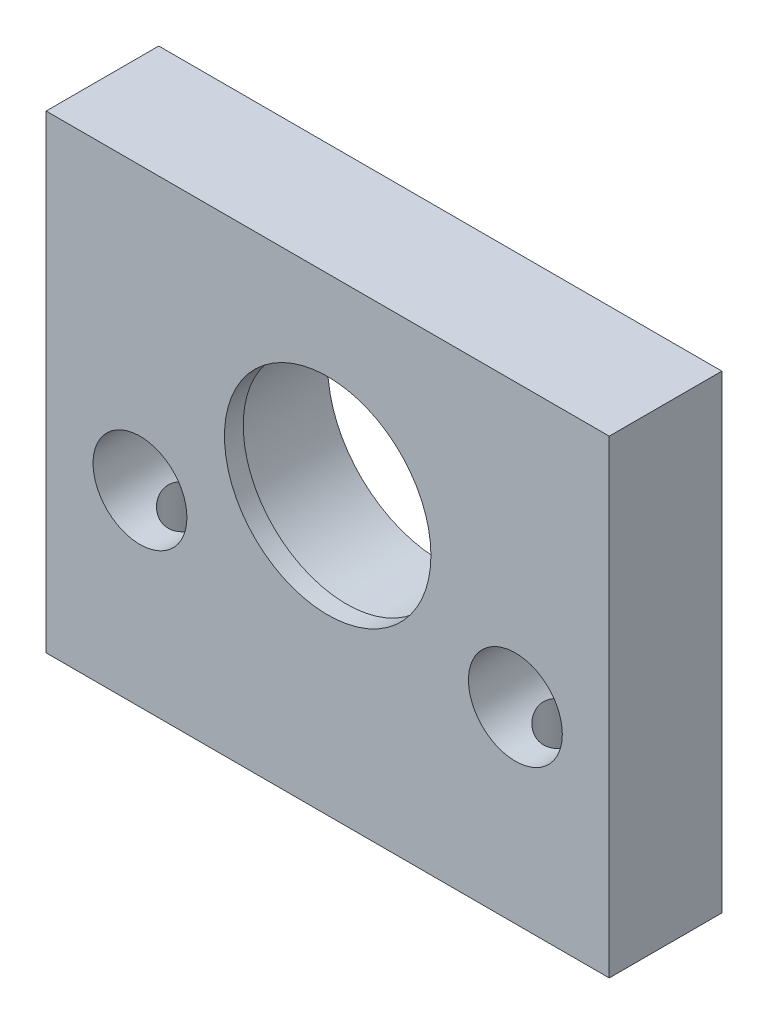
from build123d import *

# Parameters (mm, degrees)
SKETCH1_W           = 60
SKETCH1_H           = 50
BOSS_EXTRUDE1_DEPTH = 12
SKETCH2_R           = 11
CUT_EXTRUDE1_DEPTH  = 2
CUT_EXTRUDE2_REACH  = 42.853
SKETCH3_R           = 5
CUT_EXTRUDE3_REACH  = 61.532
SKETCH4_R           = 3
CUT_EXTRUDE5_REACH  = 42.311
SKETCH6_R           = 12


with BuildPart() as part:
    # Sketch1 → Boss-Extrude1 (new body)
    with BuildSketch(Plane.XY):
        Rectangle(SKETCH1_W, SKETCH1_H)
    extrude(amount=BOSS_EXTRUDE1_DEPTH)

    # Sketch2 → Cut-Extrude1 (cut)
    with BuildSketch(Plane.XY.offset(12)):
        with Locations((0, 4.5)):
            Circle(SKETCH2_R)
    extrude(amount=-CUT_EXTRUDE1_DEPTH, mode=Mode.SUBTRACT)

    # Sketch3 → Cut-Extrude2 (cut, up to next)
    with BuildSketch(Plane.XY.offset(12), mode=Mode.PRIVATE) as cut_extrude2_sk1:
        with Locations((-20, -5)):
            Circle(SKETCH3_R)
    cut_extrude2_tool1 = extrude(cut_extrude2_sk1.sketch, amount=-CUT_EXTRUDE2_REACH, mode=Mode.PRIVATE) & part.part
    # Sketch3 → Cut-Extrude2 (cut, up to next)
    with BuildSketch(Plane.XY.offset(12), mode=Mode.PRIVATE) as cut_extrude2_sk2:
        with Locations((20, -5)):
            Circle(SKETCH3_R)
    cut_extrude2_tool2 = extrude(cut_extrude2_sk2.sketch, amount=-CUT_EXTRUDE2_REACH, mode=Mode.PRIVATE) & part.part
    add(cut_extrude2_tool1.solids().sort_by_distance((-20, -5, 12))[0], mode=Mode.SUBTRACT)
    add(cut_extrude2_tool2.solids().sort_by_distance((20, -5, 12))[0], mode=Mode.SUBTRACT)

    # Sketch4 → Cut-Extrude3 (cut, up to next)
    with BuildSketch(Plane.XZ.offset(25), mode=Mode.PRIVATE) as cut_extrude3_sk1:
        with Locations(Location((20, 6, 0), (0, 0, 270))):
            Circle(SKETCH4_R)
    cut_extrude3_tool1 = extrude(cut_extrude3_sk1.sketch, amount=-CUT_EXTRUDE3_REACH, mode=Mode.PRIVATE) & part.part
    # Sketch4 → Cut-Extrude3 (cut, up to next)
    with BuildSketch(Plane.XZ.offset(25), mode=Mode.PRIVATE) as cut_extrude3_sk2:
        with Locations(Location((-20, 6, 0), (0, 0, 270))):
            Circle(SKETCH4_R)
    cut_extrude3_tool2 = extrude(cut_extrude3_sk2.sketch, amount=-CUT_EXTRUDE3_REACH, mode=Mode.PRIVATE) & part.part
    add(cut_extrude3_tool1.solids().sort_by_distance((20, -25, 6))[0], mode=Mode.SUBTRACT)
    add(cut_extrude3_tool2.solids().sort_by_distance((-20, -25, 6))[0], mode=Mode.SUBTRACT)

    # Sketch6 → Cut-Extrude5 (cut, up to next)
    with BuildSketch(Plane.XY.offset(10), mode=Mode.PRIVATE) as cut_extrude5_sk1:
        with Locations((0, 4.5)):
            Circle(SKETCH6_R)
    cut_extrude5_tool1 = extrude(cut_extrude5_sk1.sketch, amount=-CUT_EXTRUDE5_REACH, mode=Mode.PRIVATE) & part.part
    add(cut_extrude5_tool1.solids().sort_by_distance((0, 4.5, 10))[0], mode=Mode.SUBTRACT)


solid = part.part
